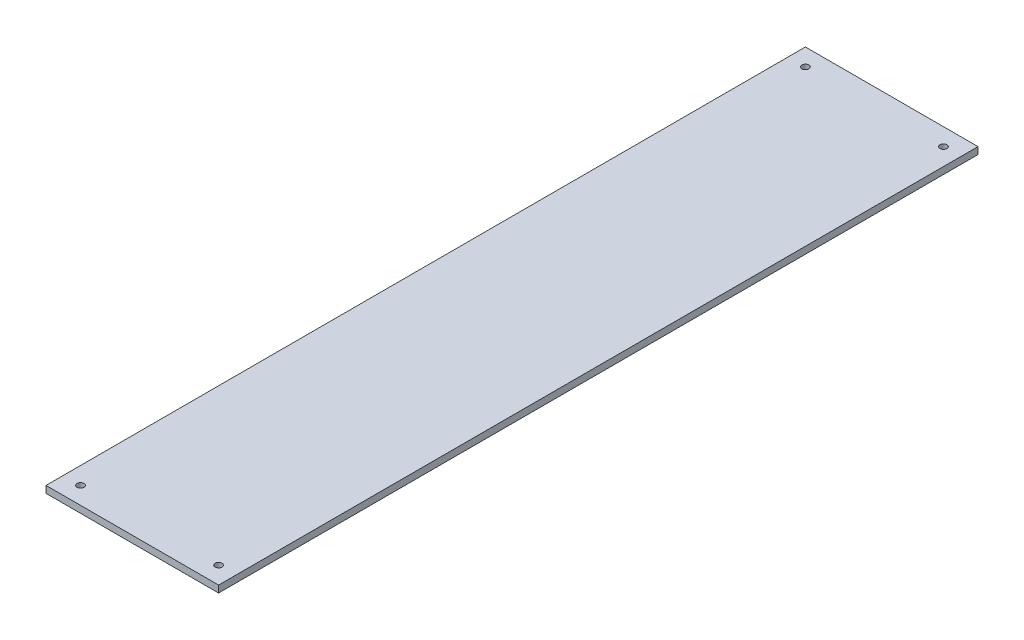
from build123d import *

# Parameters (mm, degrees)
SKETCH1_W           = 250
SKETCH1_H           = 1100
BOSS_EXTRUDE1_DEPTH = 10
SKETCH2_R           = 5
CUT_EXTRUDE1_DEPTH  = 565.11435011


with BuildPart() as part:
    # Sketch1 → Boss-Extrude1 (new body)
    with BuildSketch(Plane(origin=(0, 0, 0), x_dir=(1, 0, 0), z_dir=(0, 1, 0))):
        Rectangle(SKETCH1_W, SKETCH1_H)
    extrude(amount=BOSS_EXTRUDE1_DEPTH)

    # Sketch2 → Cut-Extrude1 (cut, through all)
    with BuildSketch(Plane(origin=(0, 10, 0), x_dir=(1, 0, 0), z_dir=(0, 1, 0))):
        with Locations(Location((100, 525, 0), (0, 0, 270))):
            Circle(SKETCH2_R)
        with Locations(Location((-100, 525, 0), (0, 0, 270))):
            Circle(SKETCH2_R)
        with Locations(Location((100, -525, 0), (0, 0, 270))):
            Circle(SKETCH2_R)
        with Locations(Location((-100, -525, 0), (0, 0, 270))):
            Circle(SKETCH2_R)
    extrude(amount=-CUT_EXTRUDE1_DEPTH, mode=Mode.SUBTRACT)


solid = part.part
